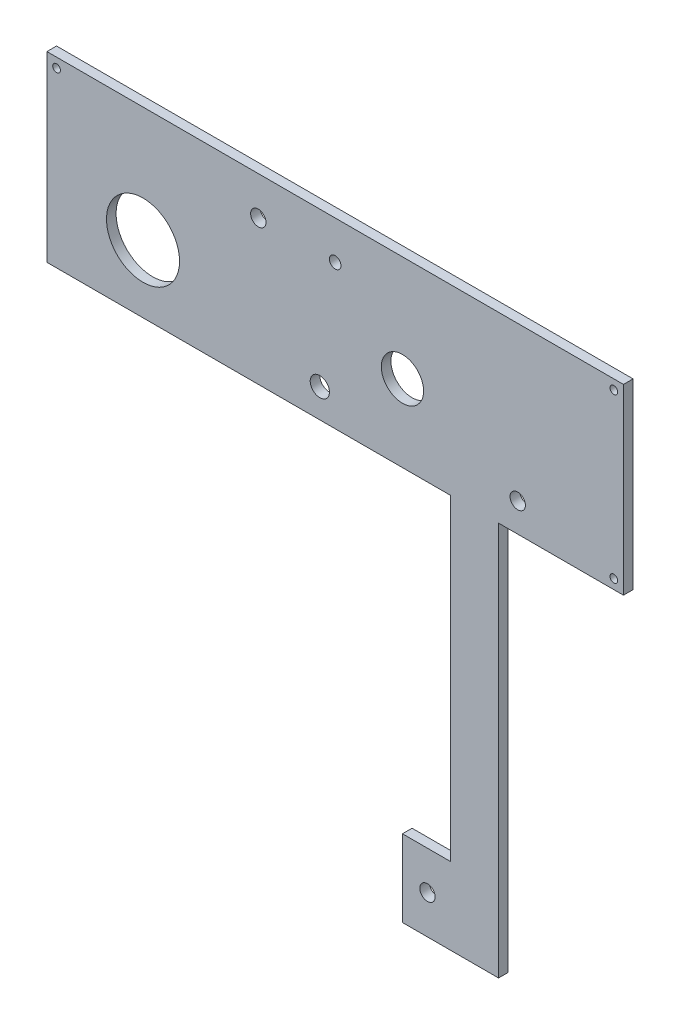
from build123d import *

# Parameters (mm, degrees)
SKETCH1_R      = 4
SKETCH1_R_2    = 11
SKETCH1_R_3    = 19
SKETCH1_R_4    = 5
SKETCH1_R_5    = 3
SKETCH1_R_6    = 2
EXTRUDE1_DEPTH = 5


with BuildPart() as part:
    # Sketch1 → Extrude1 (new body)
    with BuildSketch(Plane.XY):
        Polygon((105.426271186, -213.287288136), (55.426271186, -213.287288136), (55.426271186, -173.287288136), (80.426271186, -173.287288136), (80.426271186, -8.287288136), (-129.573728814, -8.287288136), (-129.573728814, 86.712711864), (170.426271186, 86.712711864), (170.426271186, -8.287288136), (105.426271186, -8.287288136), align=None)
        with Locations((68.426271186, -193.287288136)):
            Circle(SKETCH1_R, mode=Mode.SUBTRACT)
        with Locations((115.426271186, 6.712711864)):
            Circle(SKETCH1_R, mode=Mode.SUBTRACT)
        with Locations((55.426271186, 31.712711864)):
            Circle(SKETCH1_R_2, mode=Mode.SUBTRACT)
        with Locations((-79.573728814, 26.712711864)):
            Circle(SKETCH1_R_3, mode=Mode.SUBTRACT)
        with Locations((12.426271186, 6.712711864)):
            Circle(SKETCH1_R_4, mode=Mode.SUBTRACT)
        with Locations((20.426271186, 66.712711864)):
            Circle(SKETCH1_R_5, mode=Mode.SUBTRACT)
        with Locations((-124.573728814, 81.712711864)):
            Circle(SKETCH1_R_6, mode=Mode.SUBTRACT)
        with Locations((165.426271186, 81.712711864)):
            Circle(SKETCH1_R_6, mode=Mode.SUBTRACT)
        with Locations((165.426271186, -3.287288136)):
            Circle(SKETCH1_R_6, mode=Mode.SUBTRACT)
        with Locations((-19.573728814, 66.712711864)):
            Circle(SKETCH1_R, mode=Mode.SUBTRACT)
    extrude(amount=EXTRUDE1_DEPTH)


solid = part.part
